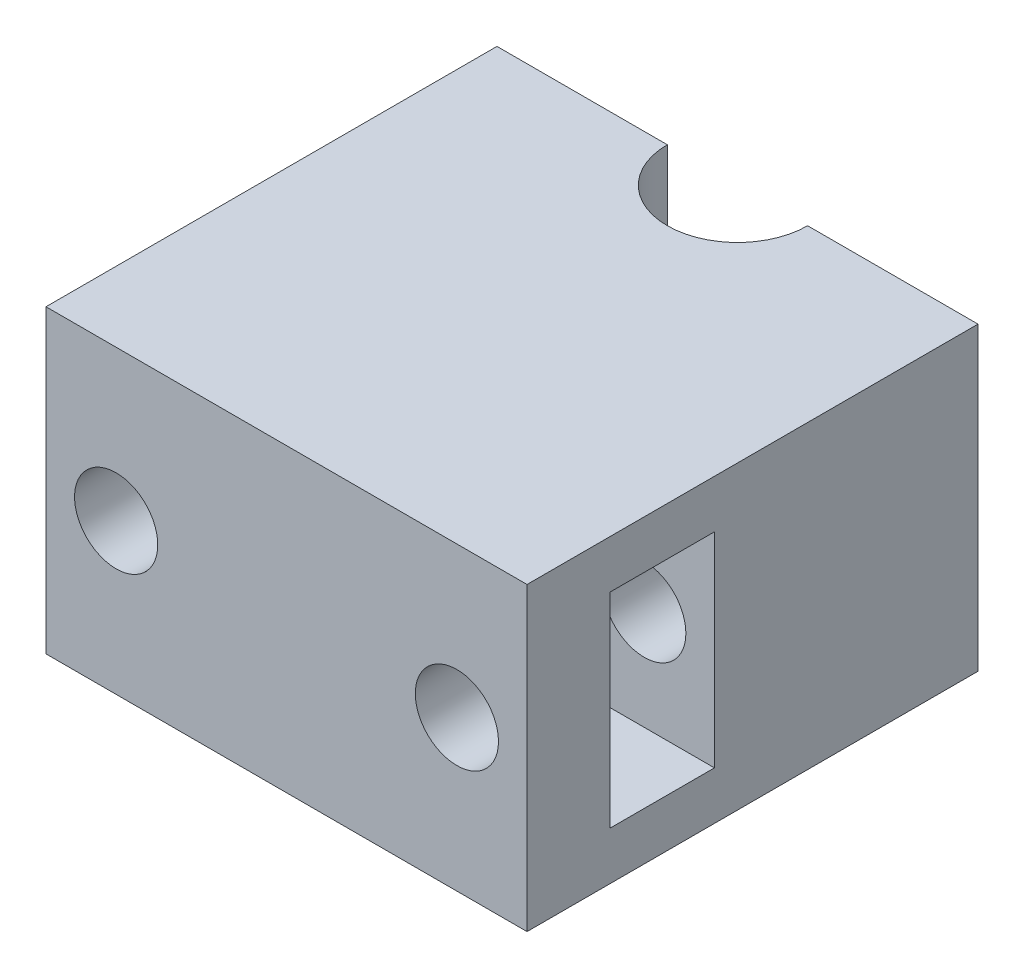
from build123d import *

# Parameters (mm, degrees)
SKETCH1_W               = 48
SKETCH1_H               = 45
BOSS_EXTRUDE1_DEPTH     = 30
SKETCH2_W               = 10.4
SKETCH2_H               = 20.4
CUT_EXTRUDE1_DEPTH      = 45
SKETCH3_R               = 4.15
CUT_EXTRUDE2_DEPTH      = 60.16924877
CUT_EXTRUDE3_DEPTH      = 45.522466239
CUT_EXTRUDE3_DEPTH_BACK = 45.522466239


with BuildPart() as part:
    # Sketch1 → Boss-Extrude1 (new body)
    with BuildSketch(Plane(origin=(0, 0, 0), x_dir=(1, 0, 0), z_dir=(0, 1, 0))):
        Rectangle(SKETCH1_W, SKETCH1_H)
    extrude(amount=BOSS_EXTRUDE1_DEPTH)

    # Sketch2 → Cut-Extrude1 (cut)
    with BuildSketch(Plane(origin=(24, 0, 0), x_dir=(0, 0, -1), z_dir=(1, 0, 0))):
        with Locations((-9, 15)):
            Rectangle(SKETCH2_W, SKETCH2_H)
    extrude(amount=-CUT_EXTRUDE1_DEPTH, mode=Mode.SUBTRACT)

    # Sketch3 → Cut-Extrude2 (cut, through all)
    with BuildSketch(Plane.XY.offset(22.5)):
        with Locations((-17, 15)):
            Circle(SKETCH3_R)
        with Locations((17, 15)):
            Circle(SKETCH3_R)
    extrude(amount=-CUT_EXTRUDE2_DEPTH, mode=Mode.SUBTRACT)

    # Sketch4 → Cut-Extrude3 (cut, two sides: drawn at the far end of the back side and taken through both)
    with BuildSketch(Plane(origin=(0, 30, 0), x_dir=(1, 0, 0), z_dir=(0, 1, 0)).offset(-CUT_EXTRUDE3_DEPTH_BACK)):
        with BuildLine():
            Line((-7, 141.788608739), (-7, 22.5))
            ThreePointArc((-7, 22.5), (0, 15.5), (7, 22.5))
            Line((7, 22.5), (7, 141.788608739))
            Line((7, 141.788608739), (7, 380.365826216))
            Line((7, 380.365826216), (-7, 380.365826216))
            Line((-7, 380.365826216), (-7, 141.788608739))
        make_face()
    extrude(amount=CUT_EXTRUDE3_DEPTH + CUT_EXTRUDE3_DEPTH_BACK, mode=Mode.SUBTRACT)


solid = part.part
